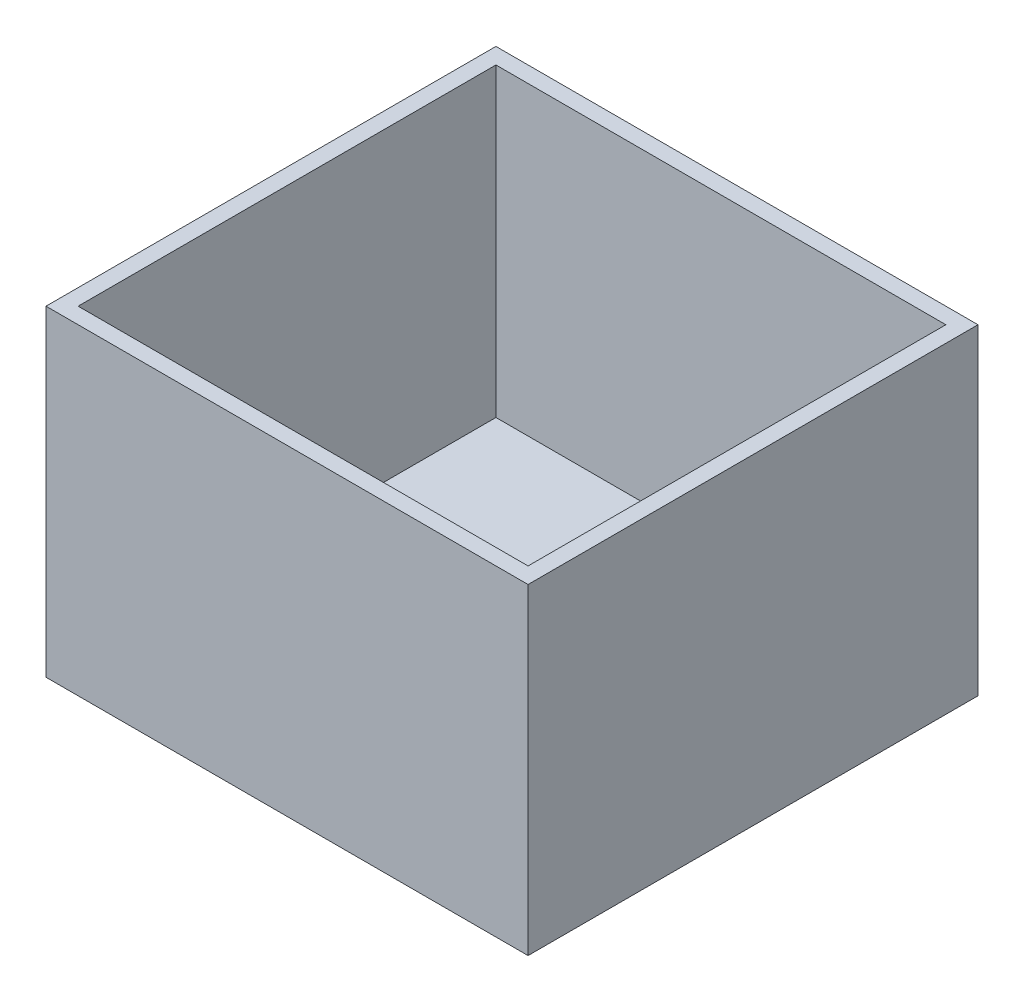
from build123d import *

# Parameters (mm, degrees)
SKETCH2_W           = 76.2
SKETCH2_H           = 71.12
BOSS_EXTRUDE1_DEPTH = 25.4
SHELL1_T            = -2.54


with BuildPart() as part:
    # Sketch2 → Boss-Extrude1 (new, symmetric)
    with BuildSketch(Plane(origin=(0, 0, 0), x_dir=(1, 0, 0), z_dir=(0, 1, 0))):
        Rectangle(SKETCH2_W, SKETCH2_H)
    extrude(amount=BOSS_EXTRUDE1_DEPTH, both=True)

    # Shell1
    shell1_openings = [part.faces().sort_by_distance(p)[0] for p in [
        (0, 25.4, 0),
    ]]
    offset(amount=SHELL1_T, openings=shell1_openings, kind=Kind.INTERSECTION)


solid = part.part
